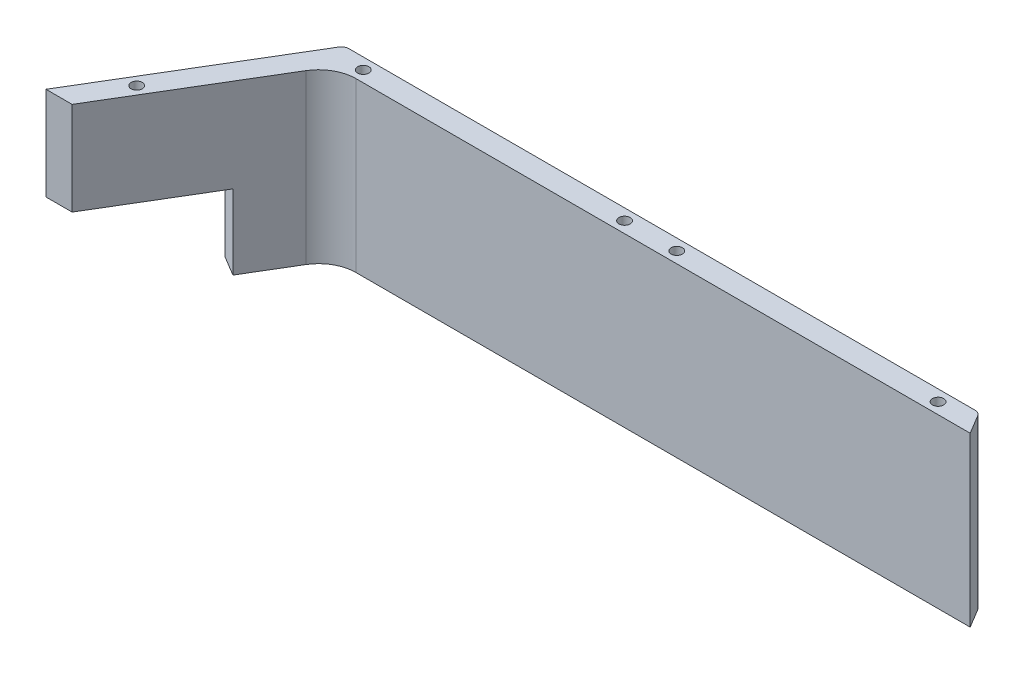
from build123d import *

# Parameters (mm, degrees)
BOSS_EXTRUDE1_DEPTH = 22.5
SKETCH2_R           = 1.5
CUT_EXTRUDE1_DEPTH  = 5
FILLET1_R           = 2
SKETCH3_W           = 35
SKETCH3_H           = 20
CUT_EXTRUDE2_DEPTH  = 10
SKETCH6_W           = 44
SKETCH6_H           = 45
CUT_EXTRUDE3_DEPTH  = 128.401923062
FILLET2_R           = 10


with BuildPart() as part:
    # Sketch1 → Boss-Extrude1 (new, symmetric)
    with BuildSketch(Plane(origin=(0, 0, 0), x_dir=(1, 0, 0), z_dir=(0, 1, 0))):
        Polygon((-115, 0), (-85, 50), (85, 50), (115, 0), (108, 0), (81.6, 44), (-81.6, 44), (-108, 0), align=None)
    extrude(amount=BOSS_EXTRUDE1_DEPTH, both=True)

    # Sketch2 → Cut-Extrude1 (cut)
    with BuildSketch(Plane(origin=(0, 22.5, 0), x_dir=(1, 0, 0), z_dir=(0, 1, 0))):
        with Locations(Location((-103.701428863, 13, 0), (0, 0, 270))):
            Circle(SKETCH2_R)
        with Locations(Location((-77, 47, 0), (0, 0, 270))):
            Circle(SKETCH2_R)
        with Locations(Location((-7, 47, 0), (0, 0, 270))):
            Circle(SKETCH2_R)
        with Locations(Location((7, 47, 0), (0, 0, 90))):
            Circle(SKETCH2_R)
        with Locations(Location((77, 47, 0), (0, 0, 90))):
            Circle(SKETCH2_R)
        with Locations(Location((103.701428863, 13, 0), (0, 0, 90))):
            Circle(SKETCH2_R)
    extrude(amount=-CUT_EXTRUDE1_DEPTH, mode=Mode.SUBTRACT)

    # Fillet1
    fillet1_edges = [part.edges().sort_by_distance(p)[0] for p in [
        (-85, 0, -50),
        (85, 0, -50),
    ]]
    fillet(fillet1_edges, radius=FILLET1_R)

    # Sketch3 → Cut-Extrude2 (cut)
    with BuildSketch(Plane(origin=(-84.558823529, 0, -50.735294118), x_dir=(-0.5144957554275263, 0, 0.8574929257125444), z_dir=(-0.8574929257125444, 0, -0.5144957554275263))):
        with Locations((41.667011874, -12.5)):
            Rectangle(SKETCH3_W, SKETCH3_H)
    extrude(amount=-CUT_EXTRUDE2_DEPTH, mode=Mode.SUBTRACT)

    # Sketch6 → Cut-Extrude3 (cut, through all)
    with BuildSketch(Plane(origin=(0, 0, 0), x_dir=(0, 0, -1), z_dir=(1, 0, 0))):
        with Locations((22, 0)):
            Rectangle(SKETCH6_W, SKETCH6_H)
    extrude(amount=CUT_EXTRUDE3_DEPTH, mode=Mode.SUBTRACT)

    # Fillet2
    fillet2_edges = [part.edges().sort_by_distance(p)[0] for p in [
        (-81.6, 0, -44),
    ]]
    fillet(fillet2_edges, radius=FILLET2_R)


solid = part.part
